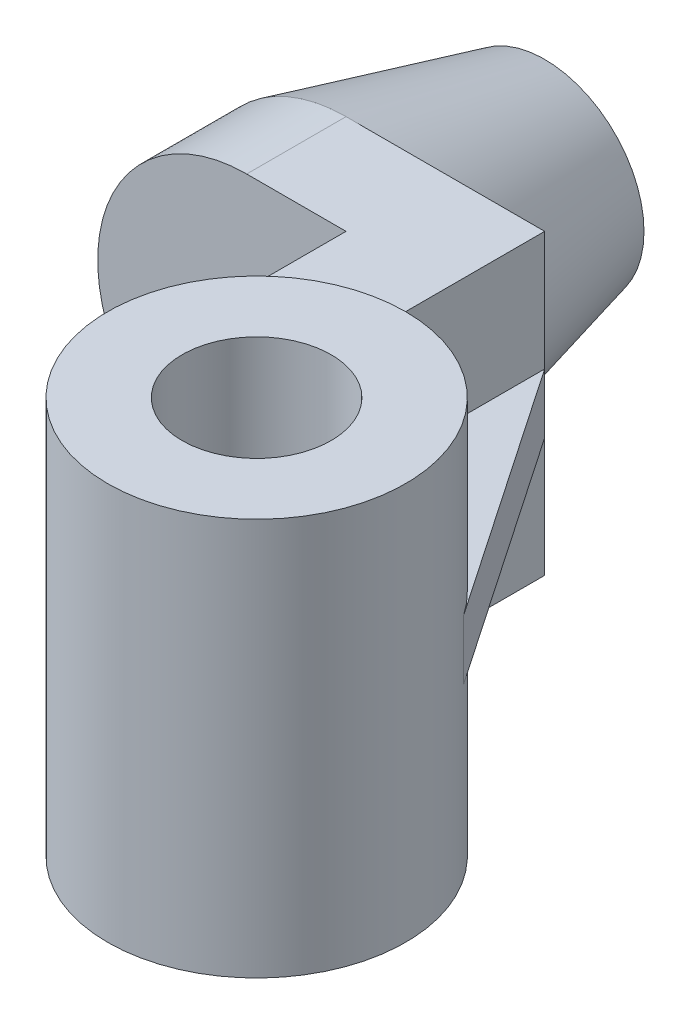
from build123d import *

# Parameters (mm, degrees)
SKETCH1_R           = 30
SKETCH1_R_2         = 15
BOSS_EXTRUDE2_DEPTH = 40
BOSS_EXTRUDE8_DEPTH = 30
BOSS_EXTRUDE9_DEPTH = 20
RIB1_REACH          = 142.228
SKETCH10_WALL_W     = 344.295269622
SKETCH10_WALL_H     = 12


with BuildPart() as part:
    # Sketch1 → Boss-Extrude2 (new, symmetric)
    with BuildSketch(Plane(origin=(0, 0, 0), x_dir=(1, 0, 0), z_dir=(0, 1, 0))):
        with Locations(Location((0, 0, 0), (0, 0, 270))):
            Circle(SKETCH1_R)
        with Locations(Location((0, 0, 0), (0, 0, 270))):
            Circle(SKETCH1_R_2, mode=Mode.SUBTRACT)
    extrude(amount=BOSS_EXTRUDE2_DEPTH, both=True)

    # Sketch2 → Boss-Extrude8 (add, symmetric)
    with BuildSketch(Plane(origin=(0, 0, 0), x_dir=(1, 0, 0), z_dir=(0, 1, 0))):
        with BuildLine():
            Line((-30, 0), (-30, 48))
            Line((-30, 48), (-50, 48))
            Line((-50, 48), (-50, 68))
            Line((-50, 68), (-30, 68))
            Line((-30, 68), (-10, 68))
            Line((-10, 68), (-10, 28.284271247))
            ThreePointArc((-10, 28.284271247), (-24.494897428, 17.320508076), (-30, 0))
        make_face()
    extrude(amount=BOSS_EXTRUDE8_DEPTH, both=True)

    # Sketch7 → Boss-Extrude9 (add)
    with BuildSketch(Plane(origin=(0, 0, -68), x_dir=(-1, 0, 0), z_dir=(0, 0, -1))):
        with BuildLine():
            Line((50, 30), (50, -30))
            ThreePointArc((50, -30), (80, 0), (50, 30))
        make_face()
    extrude(amount=-BOSS_EXTRUDE9_DEPTH)

    # Sketch9 → Revolve2 (revolve)
    with BuildSketch(Plane(origin=(0, 0, 0), x_dir=(1, 0, 0), z_dir=(0, 1, 0)), mode=Mode.PRIVATE) as revolve2_sk:
        Polygon((-80, 68), (-70, 108), (-60, 108), (-60, 68), align=None)
    revolve(revolve2_sk.sketch.rotate(Axis((-50, 0, -68), (0, 0, -1)), 180), axis=Axis((-50, 0, -68), (0, 0, -1)))

    # Sketch10 wall → Rib1 (add, up to next)
    with BuildSketch(Plane(origin=(7.39950663, 0, -42.441103916), x_dir=(0.562740261082, 0, 0.826633775355), z_dir=(0.826633775355, 0, -0.562740261082)), mode=Mode.PRIVATE) as rib1_sk1:
        Rectangle(SKETCH10_WALL_W, SKETCH10_WALL_H)
    rib1_tool1 = extrude(rib1_sk1.sketch, amount=-RIB1_REACH, mode=Mode.PRIVATE) - part.part
    add(rib1_tool1.solids().sort_by_distance((7.39950663, 0, -42.441103916))[0])


solid = part.part
